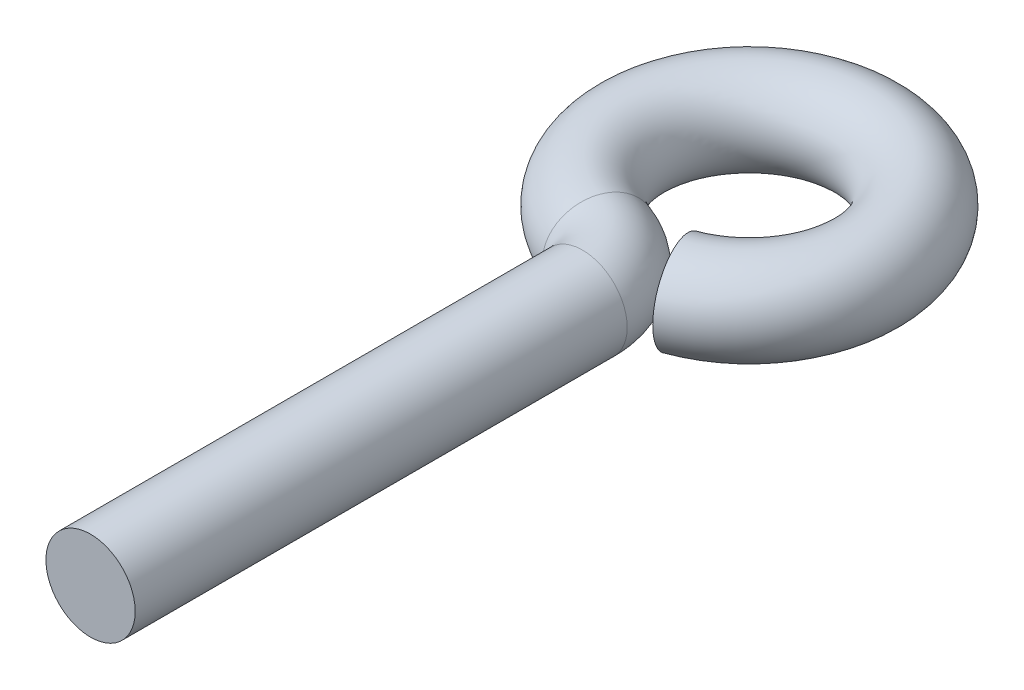
from build123d import *

# Parameters (mm, degrees)
SKETCH2_R = 1.85


with BuildPart() as part:
    # Sweep1: sweep along a path in Sketch1
    with BuildLine(Plane(origin=(0, 0, 0), x_dir=(1, 0, 0), z_dir=(0, 1, 0))) as sweep1_path:
        Line((0, -27.3), (0, -6.911765332))
        ThreePointArc((0, -6.911765332), (-0.453557924, -5.475772703), (-1.649659864, -4.560824743))
        ThreePointArc((-1.649659864, -4.560824743), (-0.004860368, 4.849997565), (1.658797695, -4.557509211))
    # Sketch2 → Sweep1 (sweep)
    with BuildSketch(Plane.XY.offset(27.3)):
        Circle(SKETCH2_R)
    sweep(path=sweep1_path.line)


solid = part.part
